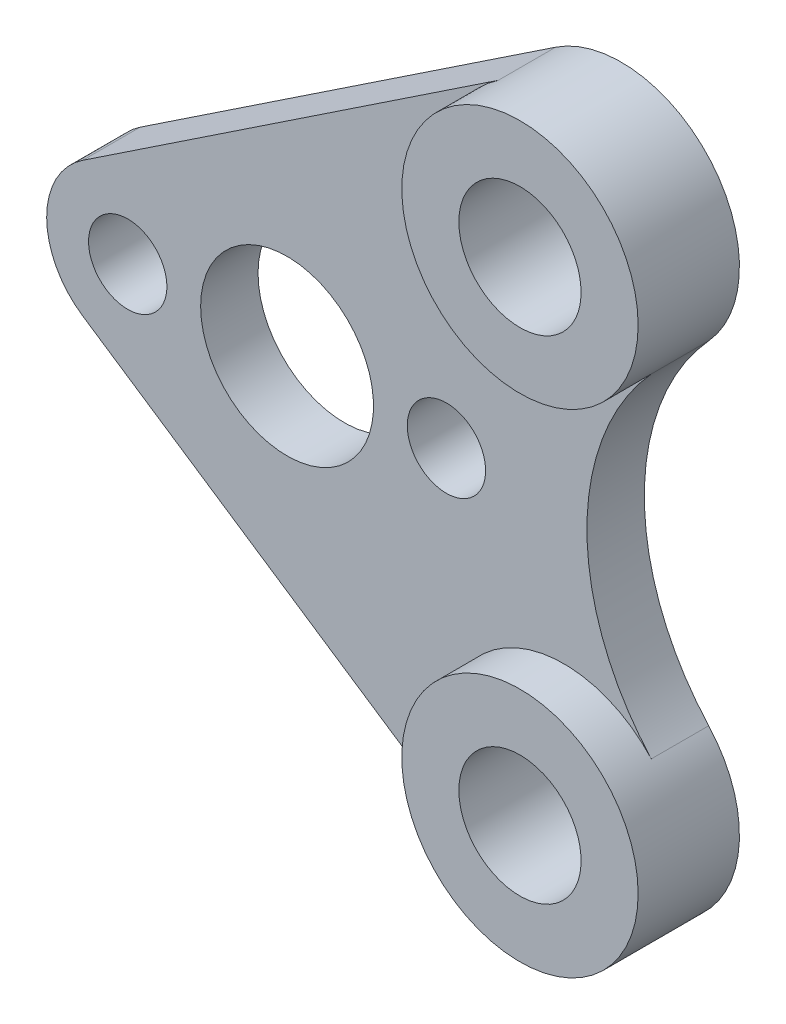
from build123d import *
from build123d.topology import SkipClean

# Parameters (mm, degrees)
SKETCH1_R           = 3.2512
SKETCH1_R_2         = 1.4732
SKETCH1_R_3         = 2.2987
BOSS_EXTRUDE1_DEPTH = 3.81
CUT_EXTRUDE2_START  = -1.651
CUT_EXTRUDE2_DEPTH  = 1.651


with BuildPart() as part:
    # Sketch1 → Boss-Extrude1 (new body)
    with BuildSketch(Plane.XY):
        with BuildLine():
            Line((7.944916334, 12.956699963), (-7.685191608, 2.536045689))
            ThreePointArc((-7.685191608, 2.536045689), (-9.0424, 0), (-7.685191608, -2.536045689))
            Line((-7.685191608, -2.536045689), (7.944916334, -12.956699963))
            ThreePointArc((7.944916334, -12.956699963), (13.779763951, -12.157804059), (13.70040037, -6.26905353))
            ThreePointArc((13.70040037, -6.26905353), (11.2776, 0), (13.70040037, 6.26905353))
            ThreePointArc((13.70040037, 6.26905353), (13.779763951, 12.157804059), (7.944916334, 12.956699963))
        make_face()
        with Locations(Location((0, 0, 0), (0, 0, 180))):
            Circle(SKETCH1_R, mode=Mode.SUBTRACT)
        with Locations(Location((-5.9944, 0, 0), (0, 0, 180))):
            Circle(SKETCH1_R_2, mode=Mode.SUBTRACT)
        with Locations(Location((5.9944, 0, 0), (0, 0, 180))):
            Circle(SKETCH1_R_2, mode=Mode.SUBTRACT)
        with Locations(Location((10.410654097, 9.2583, 0), (0, 0, 180))):
            Circle(SKETCH1_R_3, mode=Mode.SUBTRACT)
        with Locations(Location((10.410654097, -9.2583, 0), (0, 0, 180))):
            Circle(SKETCH1_R_3, mode=Mode.SUBTRACT)
    extrude(amount=BOSS_EXTRUDE1_DEPTH)

    # Sketch2 → Cut-Extrude2 (cut)
    with SkipClean():  # the faces are left unmerged after this step: merging them gives an invalid solid
        with BuildSketch(Plane.XY.offset(3.81).offset(CUT_EXTRUDE2_START)):
            with BuildLine():
                Line((7.944916334, 12.956699963), (-7.685191608, 2.536045689))
                ThreePointArc((-7.685191608, 2.536045689), (-9.0424, 0), (-7.685191608, -2.536045689))
                Line((-7.685191608, -2.536045689), (7.944916334, -12.956699963))
                ThreePointArc((7.944916334, -12.956699963), (7.041544243, -6.358795941), (13.70040037, -6.26905353))
                ThreePointArc((13.70040037, -6.26905353), (11.2776, 0), (13.70040037, 6.26905353))
                ThreePointArc((13.70040037, 6.26905353), (7.041544243, 6.358795941), (7.944916334, 12.956699963))
            make_face()
        extrude(amount=CUT_EXTRUDE2_DEPTH, mode=Mode.SUBTRACT)


solid = part.part
